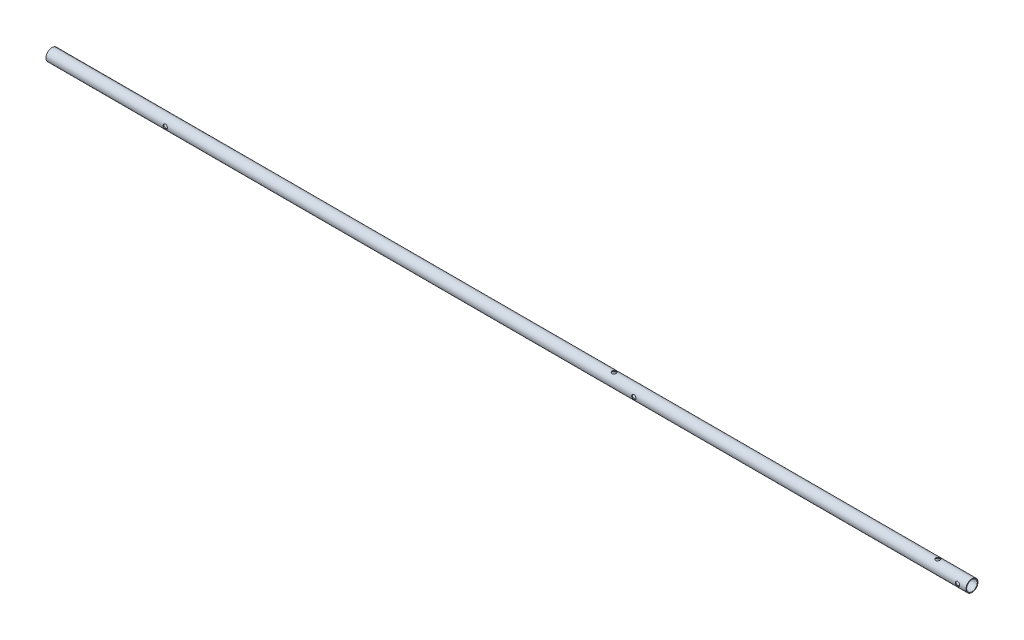
from build123d import *

# Parameters (mm, degrees)
SKETCH1_R               = 8.9662
SKETCH1_R_2             = 7.8994
BOSS_EXTRUDE1_DEPTH     = 1371.6
CUT_EXTRUDE1_DEPTH      = 1372.658611129
CUT_EXTRUDE1_DEPTH_BACK = 1372.658611129
SKETCH2_R               = 3.175
CUT_EXTRUDE2_DEPTH      = 1372.658611231
CUT_EXTRUDE2_DEPTH_BACK = 1372.658611231
SKETCH3_R               = 3.175


with BuildPart() as part:
    # Sketch1 → Boss-Extrude1 (new body)
    with BuildSketch(Plane(origin=(0, 0, 0), x_dir=(0, 0, -1), z_dir=(1, 0, 0))):
        Circle(SKETCH1_R)
        Circle(SKETCH1_R_2, mode=Mode.SUBTRACT)
    extrude(amount=BOSS_EXTRUDE1_DEPTH)

    # Sketch2 → Cut-Extrude1 (cut, two sides: drawn at the far end of the back side and taken through both)
    with BuildSketch(Plane.XY.offset(-CUT_EXTRUDE1_DEPTH_BACK)):
        with Locations((876.3, 0)):
            Circle(SKETCH2_R)
        with Locations((1358.9, 0)):
            Circle(SKETCH2_R)
        with Locations((177.8, 0)):
            Circle(SKETCH2_R)
    extrude(amount=CUT_EXTRUDE1_DEPTH + CUT_EXTRUDE1_DEPTH_BACK, mode=Mode.SUBTRACT)

    # Sketch3 → Cut-Extrude2 (cut, two sides: drawn at the far end of the back side and taken through both)
    with BuildSketch(Plane(origin=(0, 0, 0), x_dir=(1, 0, 0), z_dir=(0, 1, 0)).offset(-CUT_EXTRUDE2_DEPTH_BACK)):
        with Locations(Location((1320.8, 0, 0), (0, 0, 270))):
            Circle(SKETCH3_R)
        with Locations(Location((838.2, 0, 0), (0, 0, 270))):
            Circle(SKETCH3_R)
    extrude(amount=CUT_EXTRUDE2_DEPTH + CUT_EXTRUDE2_DEPTH_BACK, mode=Mode.SUBTRACT)


solid = part.part
